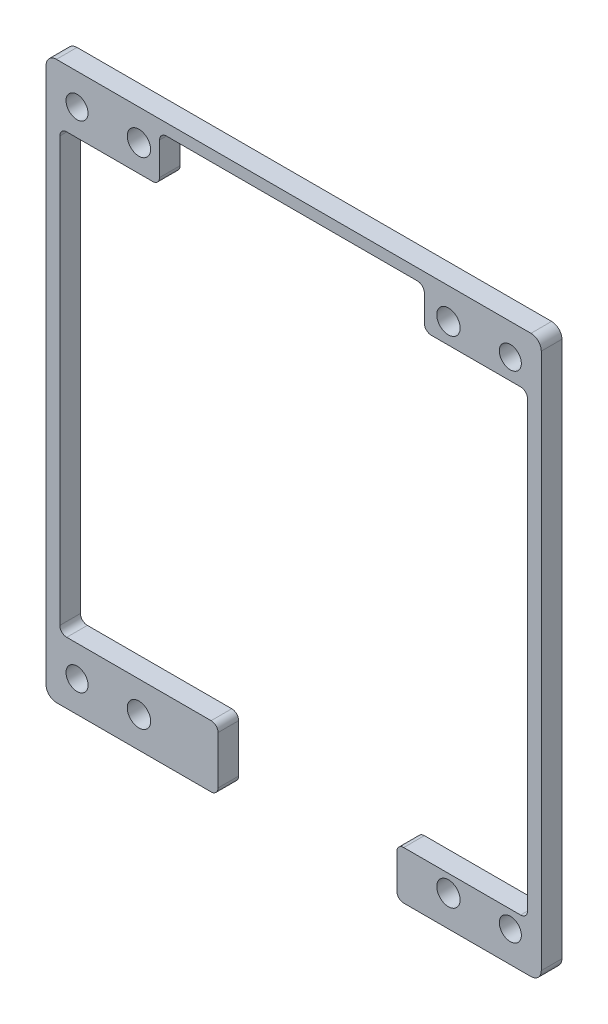
from build123d import *

# Parameters (mm, degrees)
MODEL_R                 = 1.7
MODEL_R_2               = 1.600279216
SALIENTE_EXTRUIR1_DEPTH = 3


with BuildPart() as part:
    # Model → Saliente-Extruir1 (new body)
    with BuildSketch(Plane.XY):
        with BuildLine():
            Line((74.679802956, 300.758040435), (5.677398721, 300.758040435))
            ThreePointArc((5.677398721, 300.758040435), (4.61673855, 300.318700606), (4.177398721, 299.258040435))
            Line((4.177398721, 299.258040435), (4.177398721, 221.253430577))
            ThreePointArc((4.177398721, 221.253430577), (4.61673855, 220.192770405), (5.677398721, 219.753430577))
            Line((5.677398721, 219.753430577), (28.17721751, 219.753430577))
            ThreePointArc((28.17721751, 219.753430577), (28.884324291, 220.046323796), (29.17721751, 220.753430577))
            Line((29.17721751, 220.753430577), (29.17721751, 227.730037779))
            ThreePointArc((29.17721751, 227.730037779), (28.884324291, 228.43714456), (28.17721751, 228.730037779))
            Line((28.17721751, 228.730037779), (7.17721751, 228.730037779))
            ThreePointArc((7.17721751, 228.730037779), (6.470110728, 229.022930998), (6.17721751, 229.730037779))
            Line((6.17721751, 229.730037779), (6.17721751, 291.370238846))
            ThreePointArc((6.17721751, 291.370238846), (6.470110728, 292.077345627), (7.17721751, 292.370238846))
            Line((7.17721751, 292.370238846), (19.67721751, 292.370238846))
            ThreePointArc((19.67721751, 292.370238846), (20.384324291, 292.663132064), (20.67721751, 293.370238846))
            Line((20.67721751, 293.370238846), (20.67721751, 298.097066693))
            ThreePointArc((20.67721751, 298.097066693), (20.970110728, 298.804173474), (21.67721751, 299.097066693))
            Line((21.67721751, 299.097066693), (58.179621744, 299.097066693))
            ThreePointArc((58.179621744, 299.097066693), (58.886728525, 298.804173474), (59.179621744, 298.097066693))
            Line((59.179621744, 298.097066693), (59.179621744, 294.260238845))
            ThreePointArc((59.179621744, 294.260238845), (59.472514963, 293.553132064), (60.179621744, 293.260238845))
            Line((60.179621744, 293.260238845), (73.179621744, 293.260238845))
            ThreePointArc((73.179621744, 293.260238845), (73.886728525, 292.967345627), (74.179621744, 292.260238845))
            Line((74.179621744, 292.260238845), (74.179621744, 227.755628988))
            ThreePointArc((74.179621744, 227.755628988), (73.886728525, 227.048522207), (73.179621744, 226.755628988))
            Line((73.179621744, 226.755628988), (56.179621744, 226.755628988))
            ThreePointArc((56.179621744, 226.755628988), (55.472514963, 226.462735769), (55.179621744, 225.755628988))
            Line((55.179621744, 225.755628988), (55.179621744, 220.753430577))
            ThreePointArc((55.179621744, 220.753430577), (55.472514963, 220.046323796), (56.179621744, 219.753430577))
            Line((56.179621744, 219.753430577), (74.679802956, 219.753430577))
            ThreePointArc((74.679802956, 219.753430577), (75.740463127, 220.192770405), (76.179802956, 221.253430577))
            Line((76.179802956, 221.253430577), (76.179802956, 299.258040435))
            ThreePointArc((76.179802956, 299.258040435), (75.740463127, 300.318700606), (74.679802956, 300.758040435))
        make_face()
        with Locations((17.676729717, 224.253096075)):
            Circle(MODEL_R, mode=Mode.SUBTRACT)
        with Locations((62.680137458, 224.253096075)):
            Circle(MODEL_R, mode=Mode.SUBTRACT)
        with Locations((8.677064219, 224.253096075)):
            Circle(MODEL_R_2, mode=Mode.SUBTRACT)
        with Locations((71.679802956, 224.253096075)):
            Circle(MODEL_R_2, mode=Mode.SUBTRACT)
        with Locations((17.676729717, 296.258040435)):
            Circle(MODEL_R, mode=Mode.SUBTRACT)
        with Locations((62.680137458, 296.258040435)):
            Circle(MODEL_R, mode=Mode.SUBTRACT)
        with Locations((71.679802956, 296.258040435)):
            Circle(MODEL_R_2, mode=Mode.SUBTRACT)
        with Locations((8.677064219, 296.258040435)):
            Circle(MODEL_R_2, mode=Mode.SUBTRACT)
    extrude(amount=SALIENTE_EXTRUIR1_DEPTH)


solid = part.part
